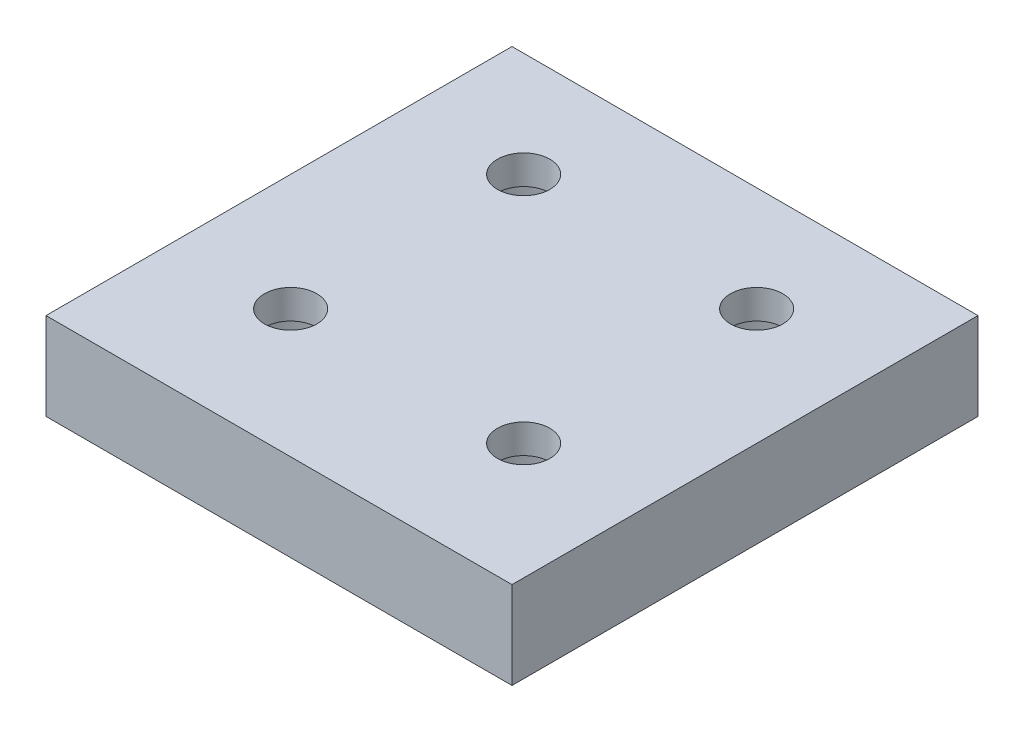
from build123d import *

# Parameters (mm, degrees)
CROQUIS1_W              = 40
CROQUIS1_H              = 40
CROQUIS1_R              = 2.25
SALIENTE_EXTRUIR1_DEPTH = 7.5
CROQUIS2_R              = 6.25
CORTAR_EXTRUIR1_DEPTH   = 5
VACIADO1_T              = -1
REDONDEO1_R             = 4


with BuildPart() as part:
    # Croquis1 → Saliente-Extruir1 (new body)
    with BuildSketch(Plane(origin=(0, 0, 0), x_dir=(1, 0, 0), z_dir=(0, 1, 0))):
        Rectangle(CROQUIS1_W, CROQUIS1_H)
        with Locations(Location((-10, -9, 0), (0, 0, 270))):
            Circle(CROQUIS1_R, mode=Mode.SUBTRACT)
        with Locations(Location((10, -9, 0), (0, 0, 270))):
            Circle(CROQUIS1_R, mode=Mode.SUBTRACT)
        with Locations(Location((10, 11, 0), (0, 0, 270))):
            Circle(CROQUIS1_R, mode=Mode.SUBTRACT)
        with Locations(Location((-10, 11, 0), (0, 0, 270))):
            Circle(CROQUIS1_R, mode=Mode.SUBTRACT)
    extrude(amount=SALIENTE_EXTRUIR1_DEPTH)

    # Croquis2 → Cortar-Extruir1 (cut)
    with BuildSketch(Plane.XZ):
        with Locations(Location((-10, 9, 0), (0, 0, 270))):
            Circle(CROQUIS2_R)
        with Locations(Location((10, 9, 0), (0, 0, 270))):
            Circle(CROQUIS2_R)
        with Locations(Location((-10, -11, 0), (0, 0, 270))):
            Circle(CROQUIS2_R)
        with Locations(Location((10, -11, 0), (0, 0, 270))):
            Circle(CROQUIS2_R)
    extrude(amount=-CORTAR_EXTRUIR1_DEPTH, mode=Mode.SUBTRACT)

    # Vaciado1
    vaciado1_openings = [part.faces().sort_by_distance(p)[0] for p in [
        (0, 0, 0.442577116),
    ]]
    offset(amount=VACIADO1_T, openings=vaciado1_openings, kind=Kind.INTERSECTION)

    # Redondeo1
    redondeo1_edges = [part.edges().sort_by_distance(p)[0] for p in [
        (-19, 3.25, -19),
        (19, 3.25, -19),
        (19, 3.25, 19),
        (-19, 3.25, 19),
    ]]
    fillet(redondeo1_edges, radius=REDONDEO1_R)


solid = part.part
